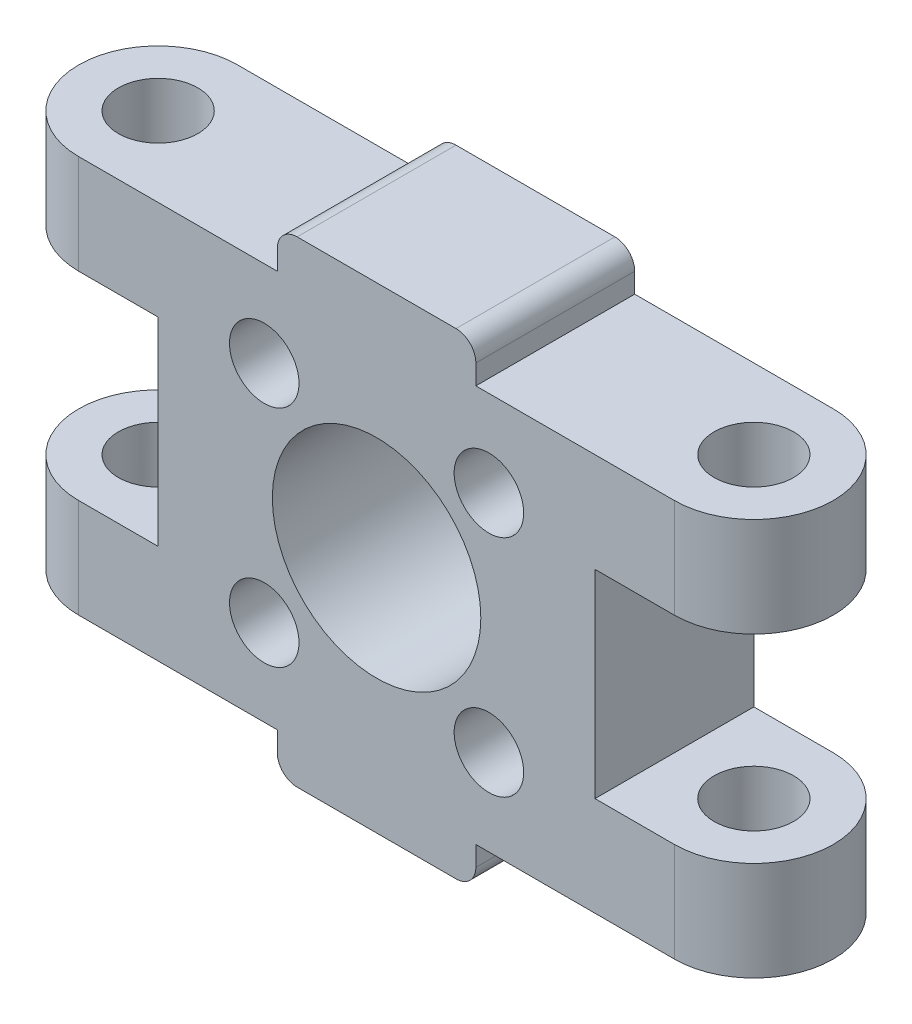
from build123d import *

# Parameters (mm, degrees)
SKETCH1_R                    = 2
BOSS_EXTRUDE1_DEPTH          = 10
CUT_EXTRUDE2_REACH           = 24.913
SKETCH3_W                    = 8
SKETCH3_H                    = 10
BOSS_EXTRUDE2_DEPTH          = 8
F_10_5_10_5_DIAMETER_HOLE1_D = 10.5
F_3_5_3_5_DIAMETER_HOLE1_D   = 3.5
FILLET1_R                    = 1


with BuildPart() as part:
    # Sketch1 → Boss-Extrude1 (new, symmetric)
    with BuildSketch(Plane(origin=(0, 0, 0), x_dir=(1, 0, 0), z_dir=(0, 1, 0))):
        with BuildLine():
            Line((15, 4), (-15, 4))
            ThreePointArc((-15, 4), (-19, 0), (-15, -4))
            Line((-15, -4), (15, -4))
            ThreePointArc((15, -4), (19, 0), (15, 4))
        make_face()
        with Locations(Location((-15, 0, 0), (0, 0, 270))):
            Circle(SKETCH1_R, mode=Mode.SUBTRACT)
        with Locations(Location((15, 0, 0), (0, 0, 270))):
            Circle(SKETCH1_R, mode=Mode.SUBTRACT)
    extrude(amount=BOSS_EXTRUDE1_DEPTH, both=True)

    # Cut-Extrude2: up to this face of the body (flat: up to its plane)
    cut_extrude2_end = Plane(part.part.faces().sort_by_distance((0, 0, -4))[0])
    # Sketch3 → Cut-Extrude2 (cut, up to the picked face)
    with BuildSketch(Plane.XY.offset(4), mode=Mode.PRIVATE) as cut_extrude2_sk1:
        with Locations((-15, 0)):
            Rectangle(SKETCH3_W, SKETCH3_H)
    cut_extrude2_tool1 = split(extrude(cut_extrude2_sk1.sketch, amount=-CUT_EXTRUDE2_REACH, mode=Mode.PRIVATE), bisect_by=cut_extrude2_end, keep=Keep.BOTH, mode=Mode.PRIVATE)
    # Sketch3 → Cut-Extrude2 (cut, up to the picked face)
    with BuildSketch(Plane.XY.offset(4), mode=Mode.PRIVATE) as cut_extrude2_sk2:
        with Locations((15, 0)):
            Rectangle(SKETCH3_W, SKETCH3_H)
    cut_extrude2_tool2 = split(extrude(cut_extrude2_sk2.sketch, amount=-CUT_EXTRUDE2_REACH, mode=Mode.PRIVATE), bisect_by=cut_extrude2_end, keep=Keep.BOTH, mode=Mode.PRIVATE)
    add(cut_extrude2_tool1.solids().sort_by(Axis((-15, 0, 4), (0, 0, -1)))[0], mode=Mode.SUBTRACT)
    add(cut_extrude2_tool2.solids().sort_by(Axis((15, 0, 4), (0, 0, -1)))[0], mode=Mode.SUBTRACT)

    # Sketch2 → Boss-Extrude2 (add)
    with BuildSketch(Plane.XY.offset(4)):
        with BuildLine():
            Line((-5, -9.797958971), (-5, -12))
            Line((-5, -12), (5, -12))
            Line((5, -12), (5, -9.797958971))
            ThreePointArc((5, -9.797958971), (11, 0), (5, 9.797958971))
            Line((5, 9.797958971), (5, 12))
            Line((5, 12), (-5, 12))
            Line((-5, 12), (-5, 9.797958971))
            ThreePointArc((-5, 9.797958971), (-11, 0), (-5, -9.797958971))
        make_face()
    extrude(amount=-BOSS_EXTRUDE2_DEPTH)

    # Ø10.5 (10.5) Diameter Hole1 (through all)
    with Locations(Plane.XY.offset(4)):
        with Locations((0, 0)):
            Hole(F_10_5_10_5_DIAMETER_HOLE1_D / 2)

    # Ø3.5 (3.5) Diameter Hole1 (through all)
    with Locations(Plane(origin=(5.656854249, 5.656854249, 4), x_dir=(1, 0, 0), z_dir=(0, 0, 1))):
        with Locations((0, 0), (0, -11.313708498), (-11.313708498, 0), (-11.313708498, -11.313708498)):
            Hole(F_3_5_3_5_DIAMETER_HOLE1_D / 2)

    # Fillet1
    fillet1_edges = [part.edges().sort_by_distance(p)[0] for p in [
        (-5, -12, 0),
        (-5, 12, 0),
        (5, 12, 0),
        (5, -12, 0),
    ]]
    fillet(fillet1_edges, radius=FILLET1_R)


solid = part.part
